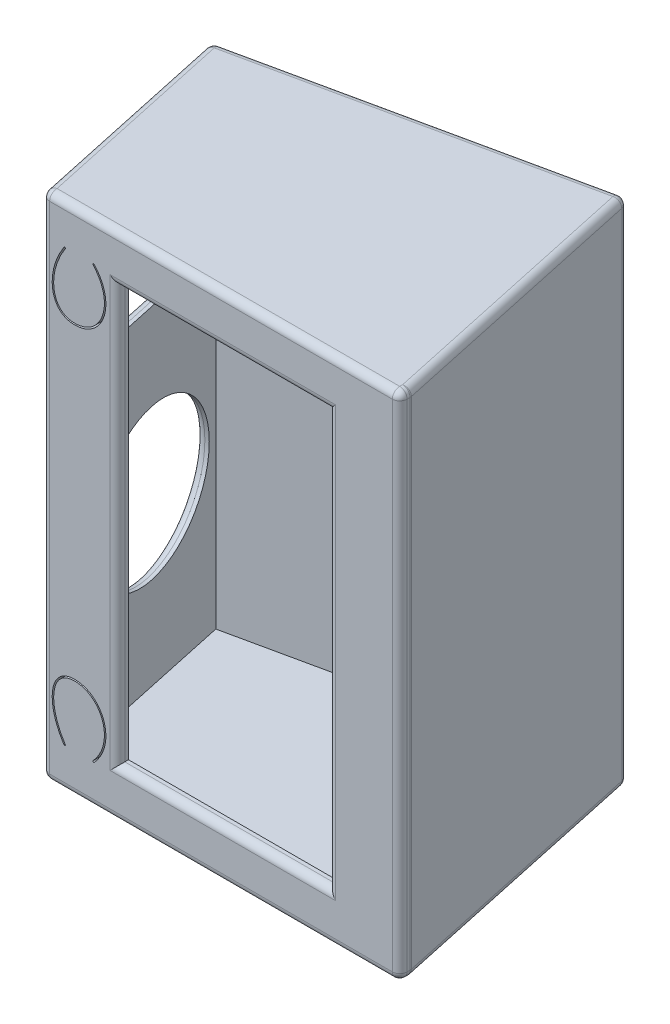
from build123d import *

# Parameters (mm, degrees)
SKETCH1_W           = 48.100100719
SKETCH1_H           = 69
SKETCH1_W_2         = 45.100100719
SKETCH1_H_2         = 66
SKETCH1_W_3         = 31.49
SKETCH1_H_3         = 59.01
SKETCH1_W_4         = 28.49
SKETCH1_H_4         = 56.01
BOSS_EXTRUDE1_DEPTH = 1.5
BOSS_EXTRUDE2_REACH = 58.343
SKETCH2_W           = 47.337403978
SKETCH2_H           = 69
SKETCH2_W_2         = 44.337403978
SKETCH2_H_2         = 66
SKETCH2_3_W         = 47.337403978
SKETCH2_3_H         = 69
BOSS_EXTRUDE3_DEPTH = 1.5
CUT_EXTRUDE1_REACH  = 62.173
CUT_EXTRUDE2_REACH  = 74.28
SKETCH4_R           = 10.1542684
SKETCH4_W           = 14.182091892
SKETCH4_H           = 8.181976091
FILLET1_R           = 1


with BuildPart() as part:
    # Sketch1 → Boss-Extrude1 (new body)
    # profile 1 of 3: a face of its own
    with BuildSketch(Plane.XY):
        with Locations((-0.154741523, 0)):
            Rectangle(SKETCH1_W, SKETCH1_H)
        with Locations((-0.154741523, 0)):
            Rectangle(SKETCH1_W_2, SKETCH1_H_2, mode=Mode.SUBTRACT)
    # profile 2 of 3: a face of its own
    with BuildSketch(Plane.XY):
        with Locations((-0.154741523, 0)):
            Rectangle(SKETCH1_W_2, SKETCH1_H_2)
        Rectangle(SKETCH1_W_3, SKETCH1_H_3, mode=Mode.SUBTRACT)
    # profile 3 of 3: a face of its own
    with BuildSketch(Plane.XY):
        Rectangle(SKETCH1_W_3, SKETCH1_H_3)
        Rectangle(SKETCH1_W_4, SKETCH1_H_4, mode=Mode.SUBTRACT)
    extrude(amount=BOSS_EXTRUDE1_DEPTH)

    # Sketch2 → Boss-Extrude2 (add, up to next)
    with BuildSketch(Plane(origin=(-6.659238528, 0, -30.914212596), x_dir=(-0.9775766209565275, 0, 0.2105800326698086), z_dir=(-0.2105800326698086, 0, -0.9775766209565275)), mode=Mode.PRIVATE) as boss_extrude2_sk1:
        with Locations((0.309206719, 0)):
            Rectangle(SKETCH2_W, SKETCH2_H)
        with Locations((0.309206719, 0)):
            Rectangle(SKETCH2_W_2, SKETCH2_H_2, mode=Mode.SUBTRACT)
    boss_extrude2_tool1 = extrude(boss_extrude2_sk1.sketch, amount=-BOSS_EXTRUDE2_REACH, mode=Mode.PRIVATE) - part.part
    add(boss_extrude2_tool1.solids().sort_by_distance((-6.961512, -33.663231, -30.8491))[0])

    # Sketch2<3> → Boss-Extrude3 (add)
    with BuildSketch(Plane(origin=(-6.659238528, 0, -30.914212596), x_dir=(-0.9775766209565275, 0, 0.2105800326698086), z_dir=(-0.2105800326698086, 0, -0.9775766209565275))):
        with Locations((0.309206719, 0)):
            Rectangle(SKETCH2_3_W, SKETCH2_3_H)
    extrude(amount=BOSS_EXTRUDE3_DEPTH)

    # Sketch3 → Cut-Extrude1 (cut, up to next)
    with BuildSketch(Plane.XY.offset(1.5), mode=Mode.PRIVATE) as cut_extrude1_sk1:
        with BuildLine():
            ThreePointArc((-21.289731657, -29.000556332), (-21.318351701, -29.139051433), (-21.456846802, -29.110431389))
            add(Edge.make_bspline(
                [(-21.456846802, -29.110431389), (-21.76735388, -28.638163734), (-22.327297073, -27.617868396), (-23.022339766, -25.632974806), (-23.184429728, -23.286569664), (-22.349812004, -21.534860233), (-21.046397057, -20.801758586), (-19.804512561, -20.676612388), (-18.519292443, -20.934519944), (-17.050207703, -21.781257639), (-16.078766807, -23.226153574), (-15.74627905, -24.98133739), (-15.854990247, -26.382669418), (-16.279006649, -27.565007319), (-16.828982995, -28.475116006), (-17.189531054, -28.926049006), (-17.379130961, -29.134965143)],
                knots=[0, 0, 0, 0, 0.0625, 0.125, 0.25, 0.375, 0.4375, 0.5, 0.5625, 0.625, 0.75, 0.8125, 0.875, 0.9375, 0.96875, 1, 1, 1, 1], degree=3))
            ThreePointArc((-17.379130961, -29.134965143), (-17.520386483, -29.141811854), (-17.527233194, -29.000556332))
            add(Edge.make_bspline(
                [(-21.289731657, -29.000556332), (-23.500889651, -25.637481941), (-23.314330036, -20.653187448), (-16.260242518, -21.102744912), (-14.890038838, -26.094687506), (-17.527233194, -29.000556332)],
                knots=[0, 0, 0, 0, 0.438563054, 0.566022066, 1, 1, 1, 1], degree=3))
        make_face()
    cut_extrude1_tool1 = extrude(cut_extrude1_sk1.sketch, amount=-CUT_EXTRUDE1_REACH, mode=Mode.PRIVATE) & part.part
    # Sketch3 → Cut-Extrude1 (cut, up to next)
    with BuildSketch(Plane.XY.offset(1.5), mode=Mode.PRIVATE) as cut_extrude1_sk2:
        with BuildLine():
            add(Edge.make_bspline(
                [(-21.456846802, 29.110431389), (-21.76735388, 28.638163734), (-22.327297073, 27.617868396), (-23.022339766, 25.632974806), (-23.184429728, 23.286569664), (-22.349812004, 21.534860233), (-21.046397057, 20.801758586), (-19.804512561, 20.676612388), (-18.519292443, 20.934519944), (-17.050207703, 21.781257639), (-16.078766807, 23.226153574), (-15.74627905, 24.98133739), (-15.854990247, 26.382669418), (-16.279006649, 27.565007319), (-16.828982995, 28.475116006), (-17.189531054, 28.926049006), (-17.379130961, 29.134965143)],
                knots=[0, 0, 0, 0, 0.0625, 0.125, 0.25, 0.375, 0.4375, 0.5, 0.5625, 0.625, 0.75, 0.8125, 0.875, 0.9375, 0.96875, 1, 1, 1, 1], degree=3))
            ThreePointArc((-17.379130961, 29.134965143), (-17.520386483, 29.141811854), (-17.527233194, 29.000556332))
            add(Edge.make_bspline(
                [(-21.289731657, 29.000556332), (-23.500889651, 25.637481941), (-23.314330036, 20.653187448), (-16.260242518, 21.102744912), (-14.890038838, 26.094687506), (-17.527233194, 29.000556332)],
                knots=[0, 0, 0, 0, 0.438563054, 0.566022066, 1, 1, 1, 1], degree=3))
            ThreePointArc((-21.289731657, 29.000556332), (-21.318351701, 29.139051433), (-21.456846802, 29.110431389))
        make_face()
    cut_extrude1_tool2 = extrude(cut_extrude1_sk2.sketch, amount=-CUT_EXTRUDE1_REACH, mode=Mode.PRIVATE) & part.part
    add(cut_extrude1_tool1.solids().sort_by_distance((-21.379464, -29.046102, 1.5))[0], mode=Mode.SUBTRACT)
    add(cut_extrude1_tool2.solids().sort_by_distance((-19.655611, 20.861949, 1.5))[0], mode=Mode.SUBTRACT)

    # Sketch4 → Cut-Extrude2 (cut, up to next)
    with BuildSketch(Plane(origin=(-23.440242972, 0, 5.049268799), x_dir=(0.21058003266980863, 0, 0.9775766209565275), z_dir=(-0.9775766209565275, 0, 0.21058003266980863)), mode=Mode.PRIVATE) as cut_extrude2_sk1:
        with Locations((-20.323314156, -10.4)):
            Circle(SKETCH4_R)
    cut_extrude2_tool1 = extrude(cut_extrude2_sk1.sketch, amount=-CUT_EXTRUDE2_REACH, mode=Mode.PRIVATE) & part.part
    # Sketch4 → Cut-Extrude2 (cut, up to next)
    with BuildSketch(Plane(origin=(-23.440242972, 0, 5.049268799), x_dir=(0.21058003266980863, 0, 0.9775766209565275), z_dir=(-0.9775766209565275, 0, 0.21058003266980863)), mode=Mode.PRIVATE) as cut_extrude2_sk2:
        with Locations((-22.959694985, 15.523026861)):
            Rectangle(SKETCH4_W, SKETCH4_H)
    cut_extrude2_tool2 = extrude(cut_extrude2_sk2.sketch, amount=-CUT_EXTRUDE2_REACH, mode=Mode.PRIVATE) & part.part
    add(cut_extrude2_tool1.solids().sort_by_distance((-27.719927, -10.4, -14.818328))[0], mode=Mode.SUBTRACT)
    add(cut_extrude2_tool2.solids().sort_by_distance((-28.275096, 15.523027, -17.395592))[0], mode=Mode.SUBTRACT)

    # Fillet1
    fillet1_edges = [part.edges().sort_by_distance(p)[0] for p in [
        (23.895308837, 0, 0),
        (-29.858213302, -10.4, -24.744903371),
        (-29.768328979, 15.523026862, -24.327632977),
        (-28.275096292, 11.432038816, -17.395592243),
        (-26.781863605, 15.523026862, -10.463551508),
        (-28.275096292, 19.614014907, -17.395592243),
        (0, 28.005, 1.5),
        (14.245, 0, 1.5),
        (23.895308837, 34.5, 0.75),
        (23.895308837, -34.5, 0.75),
        (0, -28.005, 1.5),
        (-0.154741522, 34.5, 1.5),
        (-27.310071715, 34.5, -12.915654364),
        (-24.204791882, 0, 1.5),
        (19.877948357, 34.5, -18.649810402),
        (-27.310071715, -34.5, -12.915654364),
        (19.877948357, -34.5, -18.649810402),
        (-0.154741522, -34.5, 1.5),
        (23.895308837, 0, 1.5),
        (15.860587876, 0, -37.299620805),
        (-7.277381836, 34.5, -32.315464767),
        (-7.277381836, -34.5, -32.315464767),
        (-30.415351549, 0, -27.331308728),
        (-14.245, 0, 1.5),
    ]]
    fillet(fillet1_edges, radius=FILLET1_R)


solid = part.part
